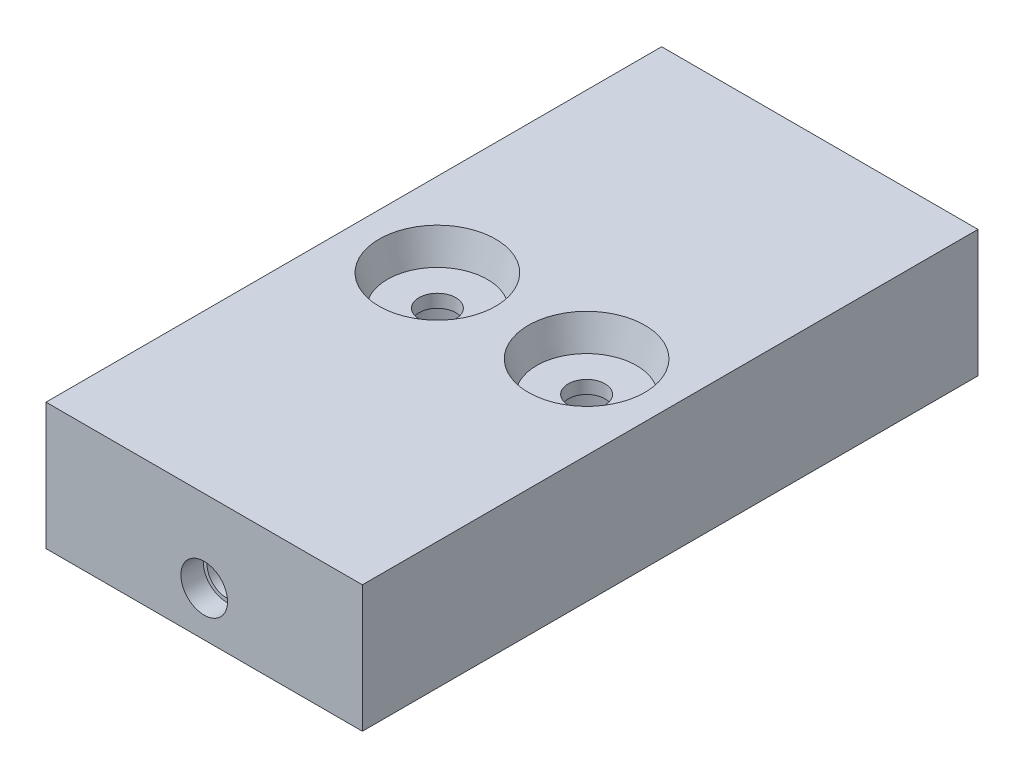
from build123d import *

# Parameters (mm, degrees)
SKETCH1_W           = 84.8
SKETCH1_H           = 165
SKETCH1_R           = 4.925
BOSS_EXTRUDE1_DEPTH = 1.75
SKETCH1_3_W         = 84.8
SKETCH1_3_H         = 165
SKETCH1_3_R         = 13.4
BOSS_EXTRUDE2_DEPTH = 10
BOSS_EXTRUDE3_START = -24
SKETCH1_4_W         = 84.8
SKETCH1_4_H         = 165
SKETCH1_4_R         = 13.4
BOSS_EXTRUDE3_DEPTH = 24
DRAFT1_ANGLE        = 15


with BuildPart() as part:
    # Sketch1 → Boss-Extrude1 (new, symmetric)
    with BuildSketch(Plane(origin=(0, 0, 0), x_dir=(1, 0, 0), z_dir=(0, 1, 0))):
        Rectangle(SKETCH1_W, SKETCH1_H)
        with Locations((-20, 0)):
            Circle(SKETCH1_R, mode=Mode.SUBTRACT)
        with Locations((20, 0)):
            Circle(SKETCH1_R, mode=Mode.SUBTRACT)
    extrude(amount=BOSS_EXTRUDE1_DEPTH, both=True)

    # Sketch1<3> → Boss-Extrude2 (add)
    with BuildSketch(Plane(origin=(0, 0, 0), x_dir=(1, 0, 0), z_dir=(0, 1, 0))):
        Rectangle(SKETCH1_3_W, SKETCH1_3_H)
        with Locations((-20, 0)):
            Circle(SKETCH1_3_R, mode=Mode.SUBTRACT)
        with Locations((20, 0)):
            Circle(SKETCH1_3_R, mode=Mode.SUBTRACT)
    extrude(amount=BOSS_EXTRUDE2_DEPTH)

    # Sketch1<4> → Boss-Extrude3 (add)
    with BuildSketch(Plane(origin=(0, 0, 0), x_dir=(1, 0, 0), z_dir=(0, 1, 0)).offset(BOSS_EXTRUDE3_START)):
        Rectangle(SKETCH1_4_W, SKETCH1_4_H)
        with Locations((-20, 0)):
            Circle(SKETCH1_4_R, mode=Mode.SUBTRACT)
        with Locations((20, 0)):
            Circle(SKETCH1_4_R, mode=Mode.SUBTRACT)
    extrude(amount=BOSS_EXTRUDE3_DEPTH)

    # Sketch3 → Cut-Revolve1 (revolve, cut)
    with BuildSketch(Plane(origin=(0, -12, 0), x_dir=(1, 0, 0), z_dir=(0, 1, 0))):
        Polygon((-6.25, -82.5), (-6.25, -76.5), (-5.25, -76.5), (-5.25, -61.5), (-4.05, -61.5), (-4.05, -47.5), (0, -47.5), (0, -82.5), align=None)
    cut_revolve1 = revolve(axis=Axis((0, -12, 82.5), (0, 0, -1)), mode=Mode.SUBTRACT)

    # Mirror1: Cut-Revolve1 across plane
    add(cut_revolve1.mirror(Plane.XY), mode=Mode.SUBTRACT)

    # Draft1
    draft1_faces = [part.faces().sort_by_distance(p)[0] for p in [
        (-33.4, 5.875, 0),
        (6.6, 5.875, 0),
    ]]
    draft(draft1_faces, Plane.ZX.offset(1.75), DRAFT1_ANGLE)


solid = part.part
